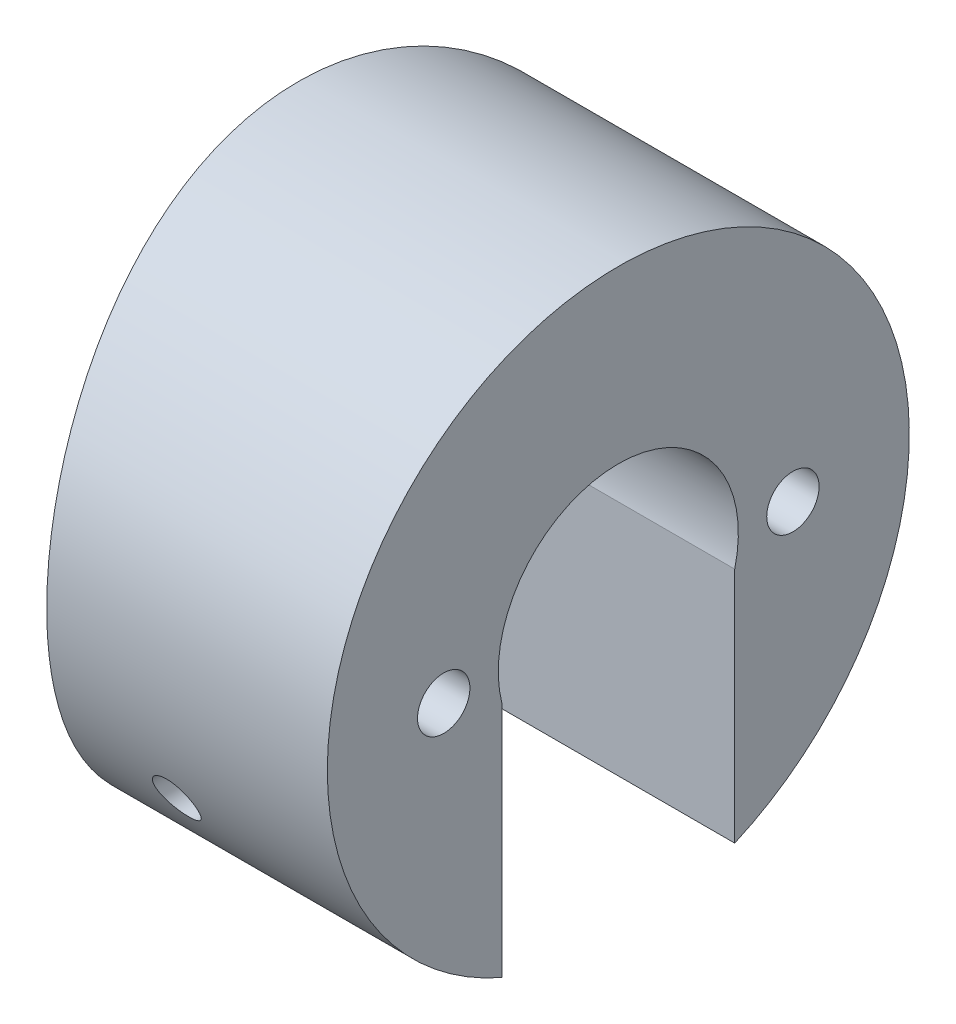
from build123d import *

# Parameters (mm, degrees)
SKETCH1_R                               = 20
BLOCO_DEPTH                             = 22
ENCAIXE_START                           = -19
ENCAIXE_DO_POTENCI_METRO_DEPTH          = 19
FURO_DE_FIXA_O_PARAFUSO_M3_D            = 3.6
FURO_DE_FIXA_O_PARAFUSO_M3_CSINK_D      = 6.72
FURO_DE_FIXA_O_PARAFUSO_M3_CSINK_ANGLE  = 90
CORTE_ARREDONDAMENTO_DEPTH              = 36.832945734
CORTE_ARREDONDAMENTO_DEPTH_BACK         = 36.832945734
SKETCH7_R                               = 100
SKETCH7_R_2                             = 75
FURO_DE_FIXA_O_POTENCI_METRO_REACH      = 37.833
FURO_DE_FIXA_O_POTENCI_METRO_END_RADIUS = 20
SKETCH8_R                               = 1.5


with BuildPart() as part:
    # Sketch1 → Bloco (new body)
    with BuildSketch(Plane(origin=(0, 0, 0), x_dir=(0, 0, -1), z_dir=(1, 0, 0))):
        Circle(SKETCH1_R)
    extrude(amount=BLOCO_DEPTH)

    # Sketch2 → Encaixe do Potenciômetro (cut)
    with BuildSketch(Plane(origin=(22, 0, 0), x_dir=(0, 0, -1), z_dir=(1, 0, 0)).offset(ENCAIXE_START)):
        with BuildLine():
            Line((-8, -18.33030278), (-8, -2.015564437))
            ThreePointArc((-8, -2.015564437), (0, 8.25), (8, -2.015564437))
            Line((8, -2.015564437), (8, -18.33030278))
            ThreePointArc((8, -18.33030278), (0, -20), (-8, -18.33030278))
        make_face()
    extrude(amount=ENCAIXE_DO_POTENCI_METRO_DEPTH, mode=Mode.SUBTRACT)

    # Furo de Fixação - Parafuso M3 (through all)
    with Locations(Plane.ZY):
        with Locations((-12, 0), (12, 0)):
            CounterSinkHole(FURO_DE_FIXA_O_PARAFUSO_M3_D / 2, FURO_DE_FIXA_O_PARAFUSO_M3_CSINK_D / 2, counter_sink_angle=FURO_DE_FIXA_O_PARAFUSO_M3_CSINK_ANGLE)

    # Sketch7 → Corte - Arredondamento (cut, two sides: drawn at the far end of the back side and taken through both)
    with BuildSketch(Plane(origin=(0, 0, 0), x_dir=(1, 0, 0), z_dir=(0, 1, 0)).offset(-CORTE_ARREDONDAMENTO_DEPTH_BACK)):
        with Locations((75, 0)):
            Circle(SKETCH7_R)
        with Locations((75, 0)):
            Circle(SKETCH7_R_2, mode=Mode.SUBTRACT)
    extrude(amount=CORTE_ARREDONDAMENTO_DEPTH + CORTE_ARREDONDAMENTO_DEPTH_BACK, mode=Mode.SUBTRACT)

    # Furo de Fixação - Potenciômetro: up to this cylinder (the profile starts inside it)
    furo_de_fixa_o_potenci_metro_end = Plane(origin=(9.5, 0, 0), z_dir=(-1, 0, 0)) * Cylinder(FURO_DE_FIXA_O_POTENCI_METRO_END_RADIUS, 116.666, mode=Mode.PRIVATE)
    # Sketch8 → Furo de Fixação - Potenciômetro (cut, up to the surface)
    with BuildSketch(Plane.XY, mode=Mode.PRIVATE) as furo_de_fixa_o_potenci_metro_sk1:
        with Locations(Location((9.5, -9, 0), (0, 0, 180))):
            Circle(SKETCH8_R)
    furo_de_fixa_o_potenci_metro_tool1 = extrude(furo_de_fixa_o_potenci_metro_sk1.sketch, amount=FURO_DE_FIXA_O_POTENCI_METRO_REACH, mode=Mode.PRIVATE) & furo_de_fixa_o_potenci_metro_end
    add(furo_de_fixa_o_potenci_metro_tool1.solids().sort_by_distance((9.5, -9, 0))[0], mode=Mode.SUBTRACT)


solid = part.part
